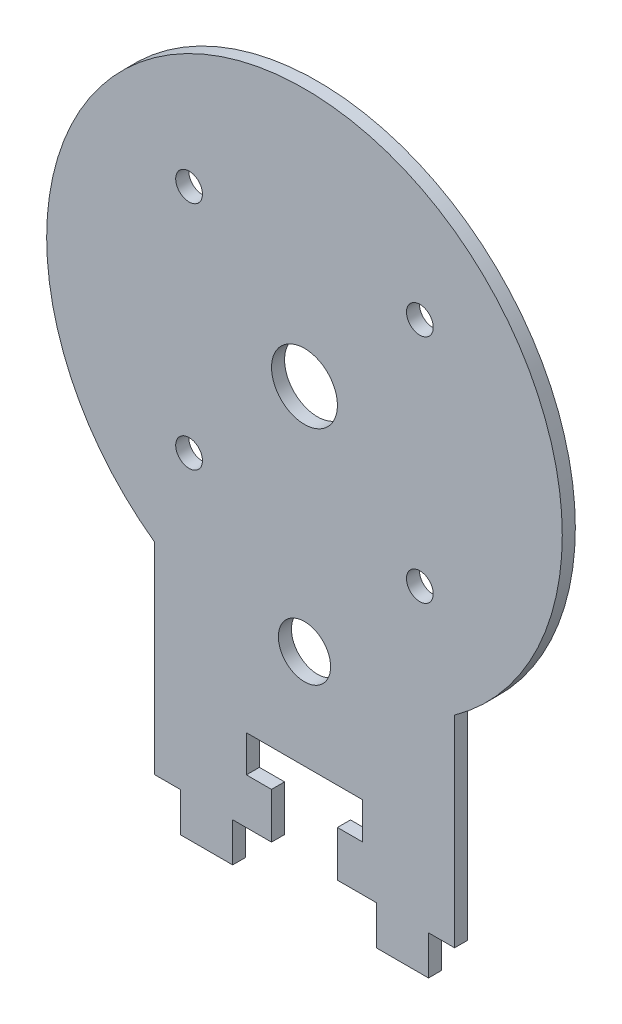
from build123d import *

# Parameters (mm, degrees)
SKETCH_1_R      = 5.05
SKETCH_1_R_2    = 2.05
SKETCH_1_R_3    = 4
EXTRUDE_1_DEPTH = 2


with BuildPart() as part:
    # 草图1 → 凸台-拉伸1 (new body)
    with BuildSketch(Plane.XY):
        with BuildLine():
            Line((-2.587732913, 20.736278596), (-2.587732913, 27.736278596))
            Line((-2.587732913, 27.736278596), (1.262267087, 27.736278596))
            Line((1.262267087, 27.736278596), (1.262267087, 33.336278596))
            Line((1.262267087, 33.336278596), (-2.687732913, 33.336278596))
            Line((-2.687732913, 33.336278596), (-12.587732913, 33.336278596))
            Line((-12.587732913, 33.336278596), (-16.537732913, 33.336278596))
            Line((-16.537732913, 33.336278596), (-16.537732913, 27.736278596))
            Line((-16.537732913, 27.736278596), (-12.687732913, 27.736278596))
            Line((-12.687732913, 27.736278596), (-12.687732913, 20.736278596))
            Line((-12.687732913, 20.736278596), (-18.637732913, 20.736278596))
            Line((-18.637732913, 20.736278596), (-18.637732913, 14.736278596))
            Line((-18.637732913, 14.736278596), (-26.637732913, 14.736278596))
            Line((-26.637732913, 14.736278596), (-26.637732913, 20.736278596))
            Line((-26.637732913, 20.736278596), (-30.637732913, 20.736278596))
            Line((-30.637732913, 20.736278596), (-30.637732913, 51.623197149))
            ThreePointArc((-30.637732913, 51.623197149), (-7.637732913, 123.236278596), (15.362267087, 51.623197149))
            Line((15.362267087, 51.623197149), (15.362267087, 20.736278596))
            Line((15.362267087, 20.736278596), (11.362267087, 20.736278596))
            Line((11.362267087, 20.736278596), (11.362267087, 14.736278596))
            Line((11.362267087, 14.736278596), (3.362267087, 14.736278596))
            Line((3.362267087, 14.736278596), (3.362267087, 20.736278596))
            Line((3.362267087, 20.736278596), (-2.587732913, 20.736278596))
        make_face()
        with Locations((-7.637732913, 83.736278596)):
            Circle(SKETCH_1_R, mode=Mode.SUBTRACT)
        with Locations((10.039936617, 66.058609066)):
            Circle(SKETCH_1_R_2, mode=Mode.SUBTRACT)
        with Locations((-25.315402443, 66.058609066)):
            Circle(SKETCH_1_R_2, mode=Mode.SUBTRACT)
        with Locations((-25.315402443, 101.413948126)):
            Circle(SKETCH_1_R_2, mode=Mode.SUBTRACT)
        with Locations((10.039936617, 101.413948126)):
            Circle(SKETCH_1_R_2, mode=Mode.SUBTRACT)
        with Locations((-7.637732913, 48.536278596)):
            Circle(SKETCH_1_R_3, mode=Mode.SUBTRACT)
    extrude(amount=EXTRUDE_1_DEPTH)


solid = part.part
